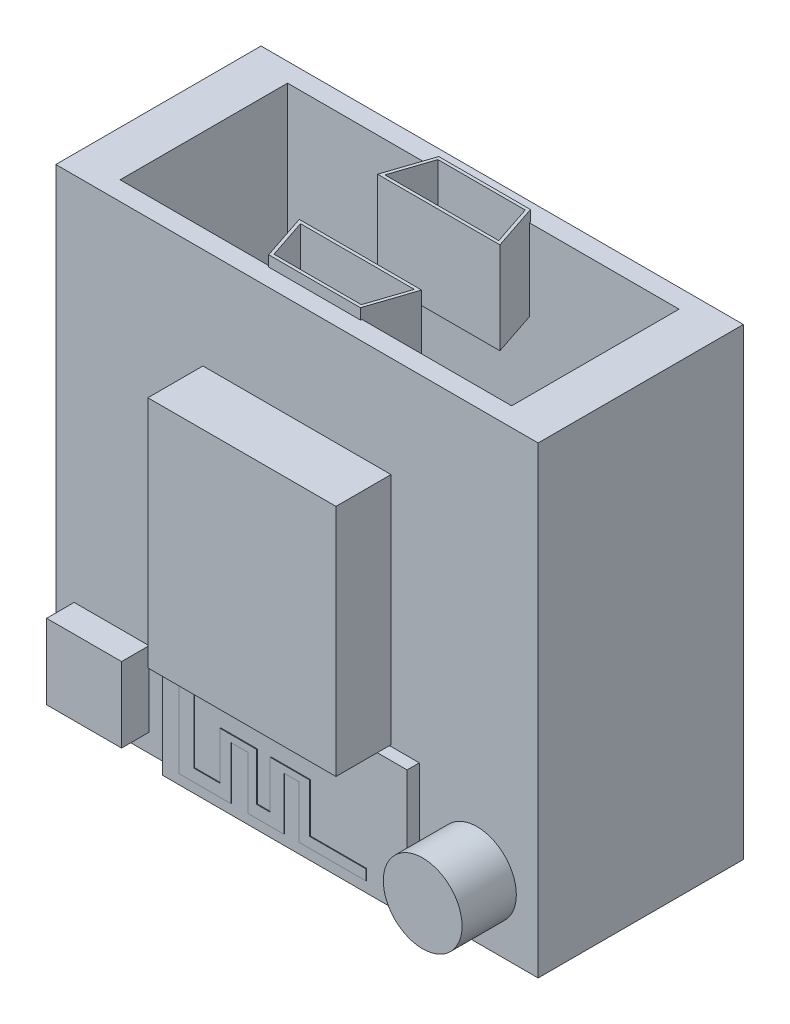
from build123d import *

# Parameters (mm, degrees)
ESQUISSE1_W             = 31.54
ESQUISSE1_H             = 30.3
BOSS_EXTRU_1_DEPTH      = 6.71
ESQUISSE2_W             = 12.3
ESQUISSE2_H             = 15.3
BOSS_EXTRU_2_DEPTH      = 3.6
ESQUISSE9_W             = 25.6
ESQUISSE9_H             = 10.95
ENL_V_MAT_EXTRU_2_DEPTH = 36.680232623
BOSS_EXTRU_3_START      = -5.3
BOSS_EXTRU_3_DEPTH      = 6
ENL_V_MAT_EXTRU_1_DEPTH = 3.4
ESQUISSE5_W             = 16
ESQUISSE5_H             = 8.3
BOSS_EXTRU_4_DEPTH      = 0.8
BOSS_EXTRU_5_DEPTH      = 0.05
ESQUISSE7_W             = 4.9
ESQUISSE7_H             = 4.9
BOSS_EXTRU_6_DEPTH      = 1.8
ESQUISSE8_R             = 2.575
BOSS_EXTRU_7_DEPTH      = 3.55
ESQUISSE10_W            = 7
ESQUISSE10_H            = 3.3
BOSS_EXTRU_8_DEPTH      = 2.45
ESQUISSE11_W            = 3
ESQUISSE11_H            = 1.48
BOSS_EXTRU_9_DEPTH      = 0.3


with BuildPart() as part:
    # Esquisse1 → Boss.-Extru.1 (new, symmetric)
    with BuildSketch(Plane.XY):
        Rectangle(ESQUISSE1_W, ESQUISSE1_H)
    extrude(amount=BOSS_EXTRU_1_DEPTH, both=True)

    # Esquisse2 → Boss.-Extru.2 (add)
    with BuildSketch(Plane.XY.offset(6.71)):
        with Locations((0, 0.9)):
            Rectangle(ESQUISSE2_W, ESQUISSE2_H)
    extrude(amount=BOSS_EXTRU_2_DEPTH)

    # Esquisse9 → Enlèv. mat.-Extru.2 (cut, through all)
    with BuildSketch(Plane(origin=(0, 15.15, 0), x_dir=(1, 0, 0), z_dir=(0, 1, 0))):
        Rectangle(ESQUISSE9_W, ESQUISSE9_H)
    extrude(amount=-ENL_V_MAT_EXTRU_2_DEPTH, mode=Mode.SUBTRACT)

    # Esquisse3 → Boss.-Extru.3 (add)
    with BuildSketch(Plane(origin=(0, 15.15, 0), x_dir=(1, 0, 0), z_dir=(0, 1, 0)).offset(BOSS_EXTRU_3_START)):
        Polygon((-4, -2.56), (-3, -5.56), (3, -5.56), (4, -2.56), align=None)
    boss_extru_3 = extrude(amount=BOSS_EXTRU_3_DEPTH)

    # Esquisse4 → Enlèv. mat.-Extru.1 (cut)
    with BuildSketch(Plane(origin=(0, 15.85, 0), x_dir=(1, 0, 0), z_dir=(0, 1, 0))):
        Polygon((3.722514823, -2.76), (-3.722514823, -2.76), (-2.855848156, -5.36), (2.855848156, -5.36), align=None)
    enl_v_mat_extru_1 = extrude(amount=-ENL_V_MAT_EXTRU_1_DEPTH, mode=Mode.SUBTRACT)

    # Symétrie1: Boss.-Extru.3, Enlèv. mat.-Extru.1 across plane
    add(boss_extru_3.mirror(Plane.XY))
    add(enl_v_mat_extru_1.mirror(Plane.XY), mode=Mode.SUBTRACT)

    # Esquisse5 → Boss.-Extru.4 (add)
    with BuildSketch(Plane.XY.offset(6.71)):
        with Locations((0, -11)):
            Rectangle(ESQUISSE5_W, ESQUISSE5_H)
    extrude(amount=BOSS_EXTRU_4_DEPTH)

    # Esquisse6 → Boss.-Extru.5 (add)
    with BuildSketch(Plane.XY.offset(7.51)):
        Polygon((-6.865802853, -7.548465464), (-5.891959411, -7.548465464), (-5.891959411, -13.672228575), (-4.191256638, -13.672228575), (-4.191256638, -11.00969053), (-4.191256638, -10.559793746), (-1.795503566, -10.559793746), (-1.795503566, -11.00969053), (-1.795503566, -13.672228575), (-0.897751783, -13.672228575), (-0.897751783, -10.559793746), (0, -10.559793746), (1.676820822, -10.559793746), (1.676820822, -11.00969053), (1.676820822, -13.751215981), (5.361136535, -13.751215981), (5.361136535, -14.43345617), (1.676820822, -14.43345617), (0.989734758, -14.43345617), (0.989734758, -11.00969053), (0, -11.00969053), (0, -13.672228575), (0, -14.470915596), (-1.795503566, -14.470915596), (-2.368009826, -14.470915596), (-2.368009826, -11.00969053), (-3.468894756, -11.00969053), (-3.468894756, -13.672228575), (-3.468894756, -14.470915596), (-5.891959411, -14.470915596), (-6.865802853, -14.470915596), align=None)
    extrude(amount=BOSS_EXTRU_5_DEPTH)

    # Esquisse7 → Boss.-Extru.6 (add)
    with BuildSketch(Plane.XY.offset(6.71)):
        with Locations((-12.12, -11.5)):
            Rectangle(ESQUISSE7_W, ESQUISSE7_H)
    extrude(amount=BOSS_EXTRU_6_DEPTH)

    # Esquisse8 → Boss.-Extru.7 (add)
    with BuildSketch(Plane.XY.offset(6.71)):
        with Locations((11.77, -11.15)):
            Circle(ESQUISSE8_R)
    extrude(amount=BOSS_EXTRU_7_DEPTH)

    # Esquisse10 → Boss.-Extru.8 (add)
    with BuildSketch(Plane.XZ.offset(15.15)):
        with Locations((0, 3.86)):
            Rectangle(ESQUISSE10_W, ESQUISSE10_H)
        with Locations((-6.475, -3.86)):
            Rectangle(ESQUISSE10_W, ESQUISSE10_H)
        with Locations((6.475, -3.86)):
            Rectangle(ESQUISSE10_W, ESQUISSE10_H)
    extrude(amount=-BOSS_EXTRU_8_DEPTH)

    # Esquisse11 → Boss.-Extru.9 (add)
    with BuildSketch(Plane.XZ.offset(15.15)):
        with Locations((0, 3.8425)):
            Rectangle(ESQUISSE11_W, ESQUISSE11_H)
        with Locations((-6.475, -3.8425)):
            Rectangle(ESQUISSE11_W, ESQUISSE11_H)
        with Locations((6.475, -3.8425)):
            Rectangle(ESQUISSE11_W, ESQUISSE11_H)
    extrude(amount=BOSS_EXTRU_9_DEPTH)


solid = part.part
